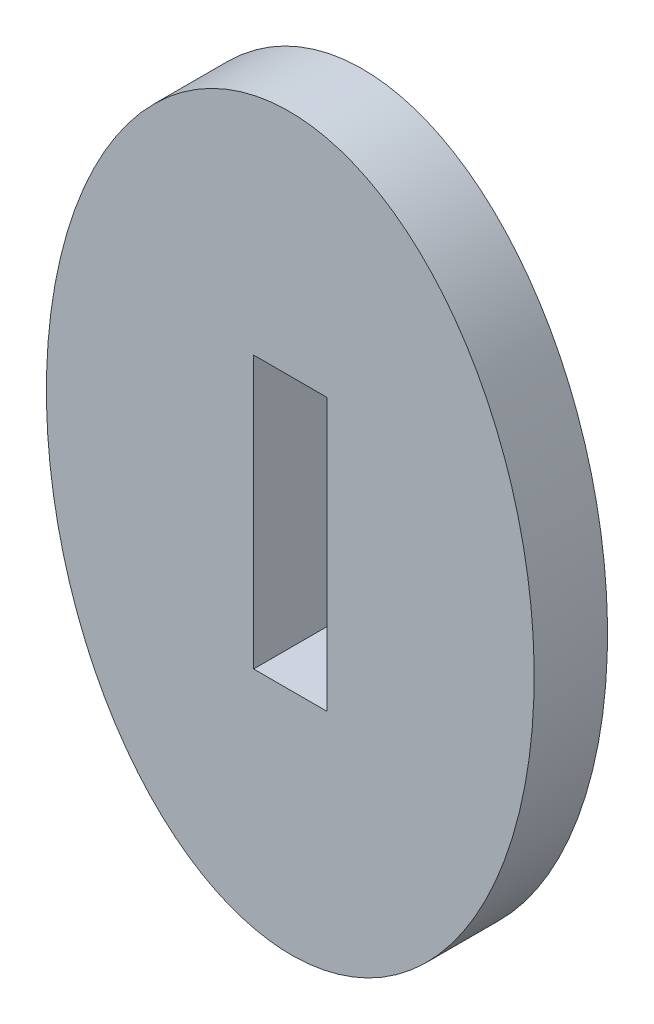
from build123d import *

# Parameters (mm, degrees)
SKETCH1_RX         = 14.919059527
SKETCH1_RY         = 9.974940077
SKETCH1_W          = 3
SKETCH1_H          = 11.12
BASE_EXTRUDE_DEPTH = 3


with BuildPart() as part:
    # Sketch1 → Base-Extrude (new body)
    with BuildSketch(Plane.XY):
        with Locations(Location((0, 0), (0, 0, -89.623387163))):
            Ellipse(SKETCH1_RX, SKETCH1_RY)
        Rectangle(SKETCH1_W, SKETCH1_H, mode=Mode.SUBTRACT)
    extrude(amount=BASE_EXTRUDE_DEPTH)


solid = part.part
